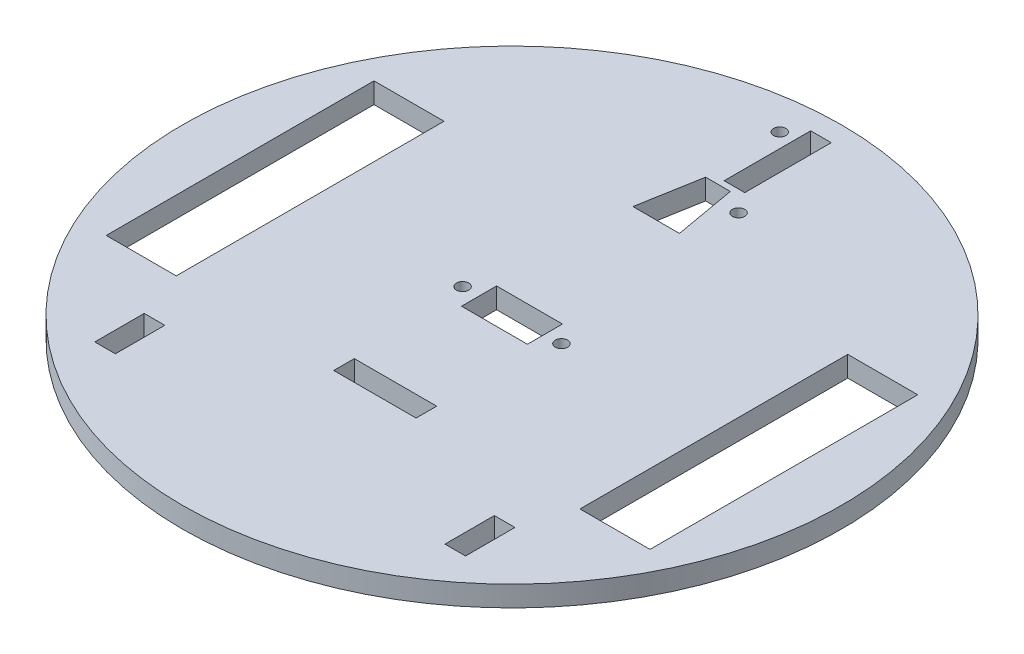
from build123d import *

# Parameters (mm, degrees)
SKETCH1_R           = 80
SKETCH1_R_2         = 1.5
SKETCH1_W           = 17
SKETCH1_H           = 65
SKETCH1_W_2         = 5
SKETCH1_H_2         = 21
SKETCH1_H_3         = 12
SKETCH1_W_3         = 20
SKETCH1_H_4         = 5
BOSS_EXTRUDE1_DEPTH = 5
SKETCH2_R           = 1.5
SKETCH2_W           = 16
SKETCH2_H           = 8.5
SAFETY_LINK_DEPTH   = 10


with BuildPart() as part:
    # Sketch1 → Boss-Extrude1 (new body)
    with BuildSketch(Plane(origin=(0, 0, 0), x_dir=(1, 0, 0), z_dir=(0, 1, 0))):
        with Locations(Location((0, 0, 0), (0, 0, 270))):
            Circle(SKETCH1_R)
        with Locations(Location((-6, 71, 0), (0, 0, 270))):
            Circle(SKETCH1_R_2, mode=Mode.SUBTRACT)
        with Locations(Location((6, 49, 0), (0, 0, 270))):
            Circle(SKETCH1_R_2, mode=Mode.SUBTRACT)
        with Locations((-57.5, 0)):
            Rectangle(SKETCH1_W, SKETCH1_H, mode=Mode.SUBTRACT)
        with Locations((57.5, 0)):
            Rectangle(SKETCH1_W, SKETCH1_H, mode=Mode.SUBTRACT)
        with Locations((0, 64.5)):
            Rectangle(SKETCH1_W_2, SKETCH1_H_2, mode=Mode.SUBTRACT)
        Polygon((-5.5, 52.5), (0.5, 52.5), (3.144904711, 37.5), (-8.144904711, 37.5), align=None, mode=Mode.SUBTRACT)
        with Locations((42.5, -50.282032303)):
            Rectangle(SKETCH1_W_2, SKETCH1_H_3, mode=Mode.SUBTRACT)
        with Locations((-42.5, -50.282032303)):
            Rectangle(SKETCH1_W_2, SKETCH1_H_3, mode=Mode.SUBTRACT)
        with Locations((0, -30.782032303)):
            Rectangle(SKETCH1_W_3, SKETCH1_H_4, mode=Mode.SUBTRACT)
    extrude(amount=BOSS_EXTRUDE1_DEPTH)

    # Sketch2 → safety_link (cut)
    with BuildSketch(Plane(origin=(0, 5, 0), x_dir=(1, 0, 0), z_dir=(0, 1, 0))):
        with Locations(Location((-12, 0, 0), (0, 0, 270))):
            Circle(SKETCH2_R)
        with Locations(Location((12, 0, 0), (0, 0, 270))):
            Circle(SKETCH2_R)
        Rectangle(SKETCH2_W, SKETCH2_H)
    extrude(amount=-SAFETY_LINK_DEPTH, mode=Mode.SUBTRACT)


solid = part.part
